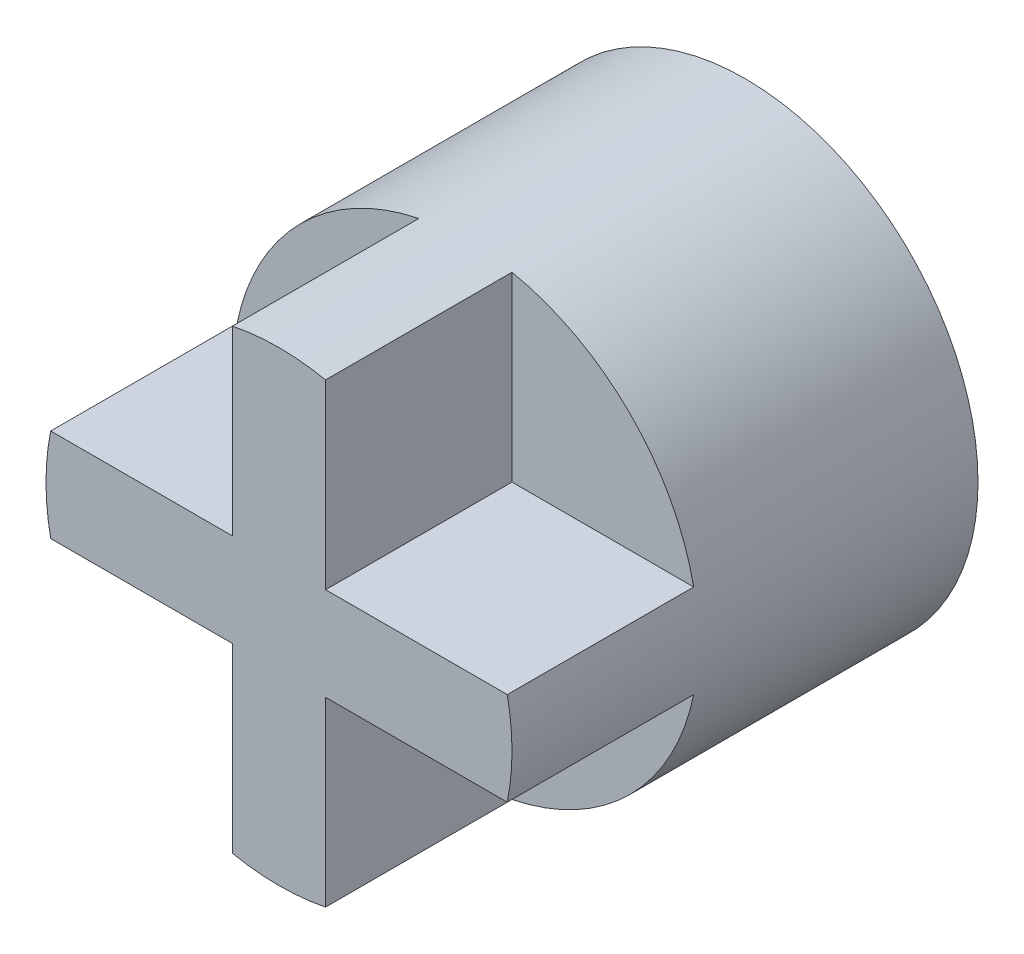
from build123d import *

# Parameters (mm, degrees)
SKETCH1_R           = 6.35
BOSS_EXTRUDE1_DEPTH = 7.62
SKETCH2_W           = 2.54
SKETCH2_H           = 2.54
BOSS_EXTRUDE2_DEPTH = 5.08
SKETCH3_R           = 3.048
CUT_EXTRUDE1_DEPTH  = 3.81


with BuildPart() as part:
    # Sketch1 → Boss-Extrude1 (new body)
    with BuildSketch(Plane.XY):
        with Locations(Location((0, 0, 0), (0, 0, 180))):
            Circle(SKETCH1_R)
    extrude(amount=BOSS_EXTRUDE1_DEPTH)

    # Sketch2 → Boss-Extrude2 (add)
    with BuildSketch(Plane.XY.offset(7.62)):
        with BuildLine():
            Line((-1.27, 1.27), (1.27, 1.27))
            Line((1.27, 1.27), (1.27, 6.221703947))
            ThreePointArc((1.27, 6.221703947), (0, 6.35), (-1.27, 6.221703947))
            Line((-1.27, 6.221703947), (-1.27, 1.27))
        make_face()
        with BuildLine():
            Line((-6.221703947, -1.27), (-1.27, -1.27))
            Line((-1.27, -1.27), (-1.27, 1.27))
            Line((-1.27, 1.27), (-6.221703947, 1.27))
            ThreePointArc((-6.221703947, 1.27), (-6.35, 0), (-6.221703947, -1.27))
        make_face()
        Rectangle(SKETCH2_W, SKETCH2_H)
        with BuildLine():
            Line((1.27, 1.27), (1.27, -1.27))
            Line((1.27, -1.27), (6.221703947, -1.27))
            ThreePointArc((6.221703947, -1.27), (6.317844572, -0.638231909), (6.35, 0))
            ThreePointArc((6.35, 0), (6.317844572, 0.638231909), (6.221703947, 1.27))
            Line((6.221703947, 1.27), (1.27, 1.27))
        make_face()
        with BuildLine():
            ThreePointArc((-1.27, -6.221703947), (0, -6.35), (1.27, -6.221703947))
            Line((1.27, -6.221703947), (1.27, -1.27))
            Line((1.27, -1.27), (-1.27, -1.27))
            Line((-1.27, -1.27), (-1.27, -6.221703947))
        make_face()
    extrude(amount=BOSS_EXTRUDE2_DEPTH)

    # Sketch3 → Cut-Extrude1 (cut)
    with BuildSketch(Plane(origin=(0, 0, 0), x_dir=(-1, 0, 0), z_dir=(0, 0, -1))):
        Circle(SKETCH3_R)
    extrude(amount=-CUT_EXTRUDE1_DEPTH, mode=Mode.SUBTRACT)


solid = part.part
